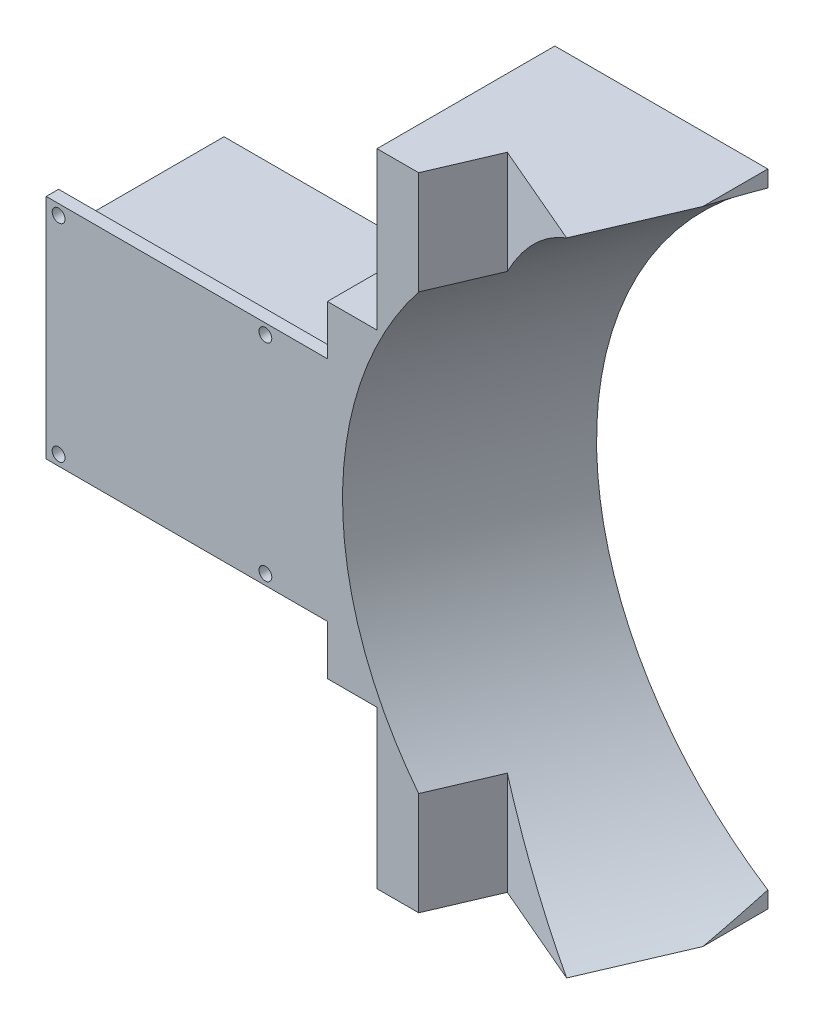
from build123d import *

# Parameters (mm, degrees)
SKETCH_1_W          = 80
SKETCH_1_H          = 55
EXTRUDE_1_DEPTH     = 3
SKETCH_2_R          = 1.55
CUT_EXTRUDE_1_DEPTH = 24.5
SKETCH_3_W          = 3
SKETCH_3_H          = 55
EXTRUDE_2_DEPTH     = 1.5
SKETCH_5_W          = 3
SKETCH_5_H          = 55
EXTRUDE_3_DEPTH     = 50
SKETCH_6_W          = 51.5
SKETCH_6_H          = 3
EXTRUDE_4_DEPTH     = 50
SKETCH_7_W          = 51.5
SKETCH_7_H          = 3
EXTRUDE_5_DEPTH     = 50
SKETCH_8_W          = 51.5
SKETCH_8_H          = 155
EXTRUDE_6_DEPTH     = 40
EXTRUDE_7_DEPTH     = 12
CUT_EXTRUDE_2_DEPTH = 184
SKETCH_13_R         = 90
CUT_EXTRUDE_3_DEPTH = 92
SKETCH_14_W         = 68
SKETCH_14_H         = 37
EXTRUDE_8_DEPTH     = 40


with BuildPart() as part:
    # 草图1 → 凸台-拉伸1 (new body)
    with BuildSketch(Plane.XY):
        Rectangle(SKETCH_1_W, SKETCH_1_H)
    extrude(amount=EXTRUDE_1_DEPTH)

    # 草图2 → 切除-拉伸1 (cut)
    with BuildSketch(Plane(origin=(0, 0, 0), x_dir=(-1, 0, 0), z_dir=(0, 0, -1))):
        with Locations((37, 25)):
            Circle(SKETCH_2_R)
        with Locations((37, -25)):
            Circle(SKETCH_2_R)
        with Locations((-13, 25)):
            Circle(SKETCH_2_R)
        with Locations((-13, -25)):
            Circle(SKETCH_2_R)
    extrude(amount=-CUT_EXTRUDE_1_DEPTH, mode=Mode.SUBTRACT)



with BuildPart() as body_2:
    # 草图3 → 凸台-拉伸2 (new body)
    with BuildSketch(Plane(origin=(40, 0, 0), x_dir=(0, 0, -1), z_dir=(1, 0, 0))):
        with Locations((-1.5, 0)):
            Rectangle(SKETCH_3_W, SKETCH_3_H)
    extrude(amount=EXTRUDE_2_DEPTH)

    # 草图5 → 凸台-拉伸3 (add)
    with BuildSketch(Plane(origin=(41.5, 0, 0), x_dir=(0, 0, -1), z_dir=(1, 0, 0))):
        with Locations((-1.5, 0)):
            Rectangle(SKETCH_5_W, SKETCH_5_H)
    extrude(amount=EXTRUDE_3_DEPTH)


with BuildPart() as part_1:
    add(part.part)

    add(body_2.part)  # 凸台-拉伸4 merges body 2
    # 草图6 → 凸台-拉伸4 (add)
    with BuildSketch(Plane(origin=(0, 27.5, 0), x_dir=(1, 0, 0), z_dir=(0, 1, 0))):
        with Locations((65.75, -1.5)):
            Rectangle(SKETCH_6_W, SKETCH_6_H)
    extrude(amount=EXTRUDE_4_DEPTH)

    # 草图7 → 凸台-拉伸5 (add)
    with BuildSketch(Plane.XZ.offset(27.5)):
        with Locations((65.75, 1.5)):
            Rectangle(SKETCH_7_W, SKETCH_7_H)
    extrude(amount=EXTRUDE_5_DEPTH)

    # 草图8 → 凸台-拉伸6 (add)
    with BuildSketch(Plane(origin=(0, 0, 0), x_dir=(-1, 0, 0), z_dir=(0, 0, -1))):
        with Locations((-65.75, 0)):
            Rectangle(SKETCH_8_W, SKETCH_8_H)
    extrude(amount=EXTRUDE_6_DEPTH)

    # 草图9 → 凸台-拉伸7 (add)
    with BuildSketch(Plane.ZY.offset(-40)):
        Polygon((-40, 39.5), (3, 39.5), (3, 27.5), (0, 27.5), (0, -27.5), (3, -27.5), (3, -39.5), (-40, -39.5), align=None)
    extrude(amount=EXTRUDE_7_DEPTH)

    # 草图10 → 切除-拉伸2 (cut)
    with BuildSketch(Plane(origin=(0, 77.5, 0), x_dir=(1, 0, 0), z_dir=(0, 1, 0))):
        Polygon((56.5, 12), (91.5, -3), (50.071428571, -3), align=None)
    extrude(amount=-CUT_EXTRUDE_2_DEPTH, mode=Mode.SUBTRACT)

    # 草图13 → 切除-拉伸3 (cut, symmetric)
    with BuildSketch(Plane(origin=(13.112068966, 0, -30.594827586), x_dir=(0.9191450300180579, 0, 0.39391929857916774), z_dir=(-0.39391929857916774, 0, 0.9191450300180579))):
        with Locations((120.283528142, 0)):
            Circle(SKETCH_13_R)
    extrude(amount=CUT_EXTRUDE_3_DEPTH, both=True, mode=Mode.SUBTRACT)

    # 草图14 → 凸台-拉伸8 (add)
    with BuildSketch(Plane(origin=(0, 0, 0), x_dir=(-1, 0, 0), z_dir=(0, 0, -1))):
        with Locations((6, 0)):
            Rectangle(SKETCH_14_W, SKETCH_14_H)
    extrude(amount=EXTRUDE_8_DEPTH)


solid = part_1.part
